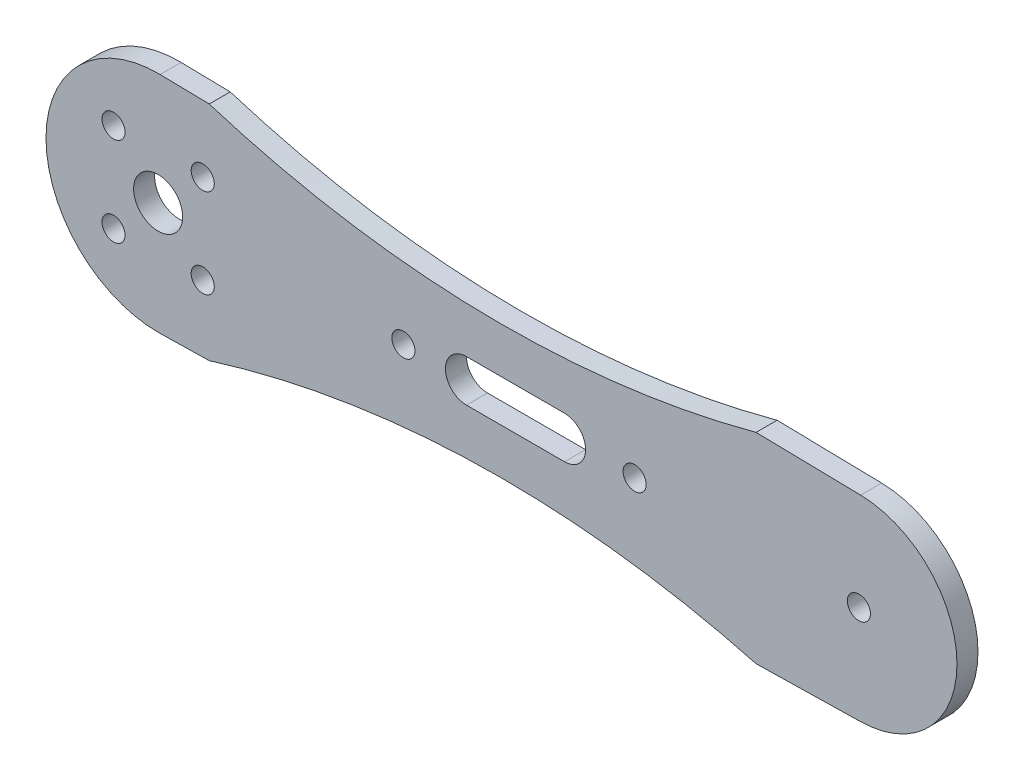
from build123d import *

# Parameters (mm, degrees)
PLASTINA_DEPTH        = 3
OTVERSTIYA_DEPTH      = 116.156318141
OTVERSTIYA_DEPTH_BACK = 116.156318141
ESKIZ_OTVERSTIYA_R    = 1.65
ESKIZ_OTVERSTIYA_R_2  = 3.5


with BuildPart() as part:
    # Eskiz_kontur → Plastina (new body)
    with BuildSketch(Plane.XY):
        with BuildLine():
            Line((7.29115, -15.8573), (0.27924, -15.99756))
            ThreePointArc((0.27924, -15.99756), (-15.999996904, 0), (0.27924, 15.99756))
            Line((0.27924, 15.99756), (7.29115, 15.8573))
            ThreePointArc((7.29115, 15.8573), (46.200008227, 9.528004702), (85.330859965, 14.296198255))
            Line((85.330859965, 14.296198255), (100.244329965, 13.997868255))
            ThreePointArc((100.244329965, 13.997868255), (113.999902223, 0), (100.244329965, -13.997868255))
            Line((100.244329965, -13.997868255), (85.330859965, -14.296198255))
            ThreePointArc((85.330859965, -14.296198255), (46.200008227, -9.528004702), (7.29115, -15.8573))
        make_face()
        with BuildLine():
            Line((58, 3), (44, 3))
            ThreePointArc((44, 3), (41, 0), (44, -3))
            Line((44, -3), (58, -3))
            ThreePointArc((58, -3), (61, 0), (58, 3))
        make_face(mode=Mode.SUBTRACT)
    extrude(amount=PLASTINA_DEPTH)

    # Eskiz_otverstiya → Otverstiya (cut, two sides: drawn at the far end of the back side and taken through both)
    with BuildSketch(Plane.XY.offset(-OTVERSTIYA_DEPTH_BACK)):
        with Locations((-6.36396, -6.36396)):
            Circle(ESKIZ_OTVERSTIYA_R)
        with Locations((6.36396, -6.36396)):
            Circle(ESKIZ_OTVERSTIYA_R)
        Circle(ESKIZ_OTVERSTIYA_R_2)
        with Locations((35, 0)):
            Circle(ESKIZ_OTVERSTIYA_R)
        with Locations((-6.36396, 6.36396)):
            Circle(ESKIZ_OTVERSTIYA_R)
        with Locations((6.36396, 6.36396)):
            Circle(ESKIZ_OTVERSTIYA_R)
        with Locations((68, 0)):
            Circle(ESKIZ_OTVERSTIYA_R)
        with Locations((100, 0)):
            Circle(ESKIZ_OTVERSTIYA_R)
    extrude(amount=OTVERSTIYA_DEPTH + OTVERSTIYA_DEPTH_BACK, mode=Mode.SUBTRACT)


solid = part.part
